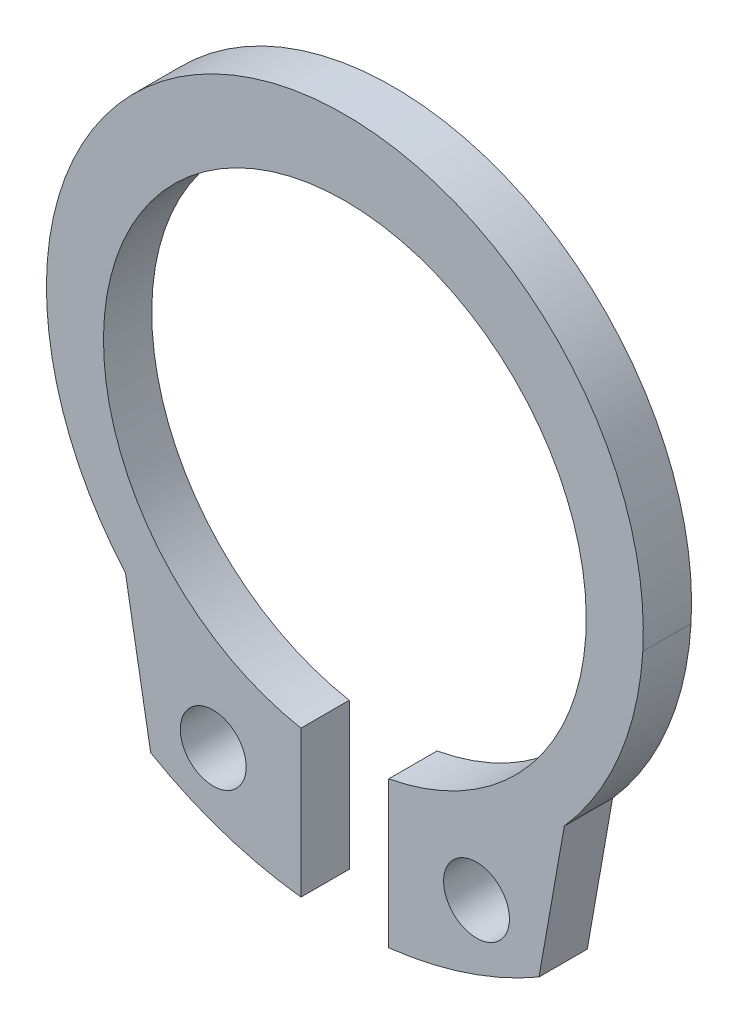
from build123d import *

# Parameters (mm, degrees)
SKETCH_1_R               = 5.5
EXTRUDE_1_DEPTH          = 1.1
CUT_EXTRUDE_1_DEPTH      = 12.175419455
CUT_EXTRUDE_1_DEPTH_BACK = 1.1
SKETCH_2_W               = 2
SKETCH_2_H               = 8.74586507
SKETCH_3_R               = 0.75
CUT_EXTRUDE_1_2_DEPTH    = 12.130588484


with BuildPart() as part:
    # 草图1 → 凸台-拉伸1 (new body)
    with BuildSketch(Plane.XY):
        with BuildLine():
            Line((-5, -4.339608214), (-4.423832973, -7.607213802))
            ThreePointArc((-4.423832973, -7.607213802), (0, -8.8), (4.423832973, -7.607213802))
            Line((4.423832973, -7.607213802), (5, -4.339608214))
            ThreePointArc((5, -4.339608214), (6.257657716, -2.319610394), (6.788225099, 0))
            ThreePointArc((6.788225099, 0), (0, 7.2), (-6.788225099, 0))
            ThreePointArc((-6.788225099, 0), (-6.257657716, -2.319610394), (-5, -4.339608214))
        make_face()
        Circle(SKETCH_1_R, mode=Mode.SUBTRACT)
    extrude(amount=EXTRUDE_1_DEPTH)

    # 草图2 → Cut-Extrude 1 (cut, two sides: drawn at the far end of the back side and taken through both)
    with BuildSketch(Plane.XY.offset(1.1).offset(-CUT_EXTRUDE_1_DEPTH_BACK)):
        with Locations((0, -8.997615825)):
            Rectangle(SKETCH_2_W, SKETCH_2_H)
    extrude(amount=CUT_EXTRUDE_1_DEPTH + CUT_EXTRUDE_1_DEPTH_BACK, mode=Mode.SUBTRACT)

    # 草图3 → Cut-Extrude 1 2 (cut, through all)
    with BuildSketch(Plane.XY.offset(1.1)):
        with Locations((3, -6.801492871)):
            Circle(SKETCH_3_R)
        with Locations((-3, -6.801492871)):
            Circle(SKETCH_3_R)
    extrude(amount=-CUT_EXTRUDE_1_2_DEPTH, mode=Mode.SUBTRACT)


solid = part.part
